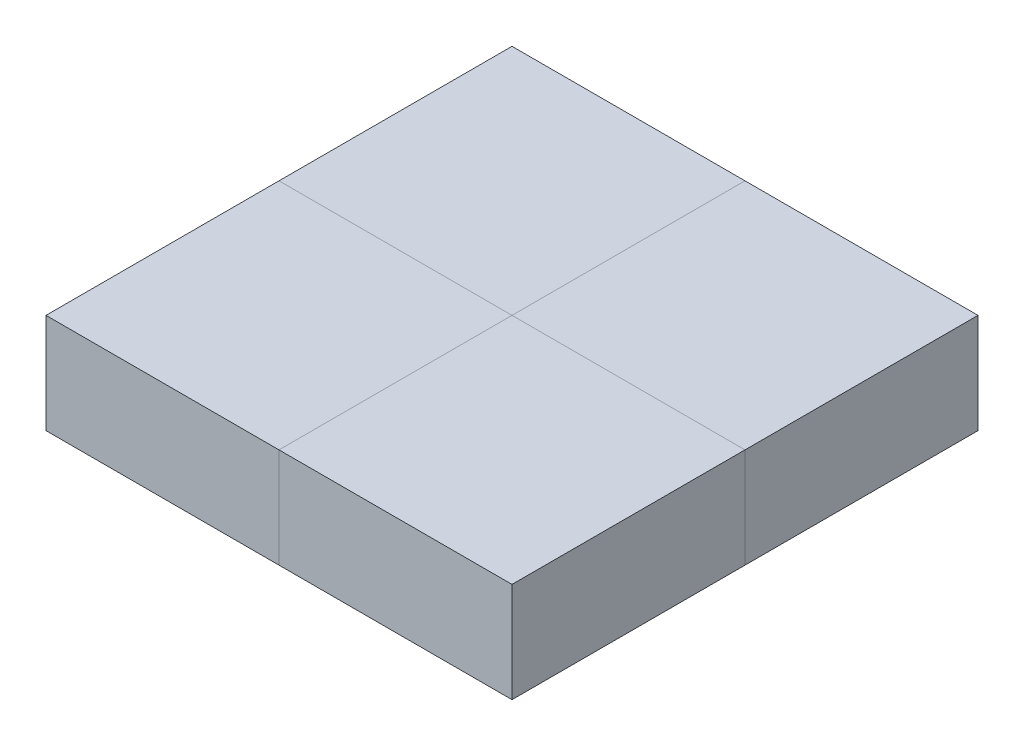
from build123d import *

# Parameters (mm, degrees)
SKETCH1_W           = 44.45
SKETCH1_H           = 44.45
BOSS_EXTRUDE1_DEPTH = 19.05
SKETCH3_W           = 44.45
SKETCH3_H           = 44.45
BOSS_EXTRUDE2_DEPTH = 19.05
SKETCH4_W           = 44.45
SKETCH4_H           = 44.45
BOSS_EXTRUDE3_DEPTH = 19.05
SKETCH5_W           = 44.45
SKETCH5_H           = 44.45
BOSS_EXTRUDE4_DEPTH = 19.05


with BuildPart() as part:
    # Sketch1 → Boss-Extrude1 (new body)
    with BuildSketch(Plane(origin=(0, 0, 0), x_dir=(1, 0, 0), z_dir=(0, 1, 0))):
        Rectangle(SKETCH1_W, SKETCH1_H)
    extrude(amount=BOSS_EXTRUDE1_DEPTH)


with BuildPart() as body_2:
    # Sketch3 → Boss-Extrude2 (new body)
    with BuildSketch(Plane(origin=(0, 0, 0), x_dir=(1, 0, 0), z_dir=(0, 1, 0))):
        with Locations((44.45, 0)):
            Rectangle(SKETCH3_W, SKETCH3_H)
    extrude(amount=BOSS_EXTRUDE2_DEPTH)


with BuildPart() as body_3:
    # Sketch4 → Boss-Extrude3 (new body)
    with BuildSketch(Plane(origin=(0, 0, 0), x_dir=(1, 0, 0), z_dir=(0, 1, 0))):
        with Locations((0, -44.45)):
            Rectangle(SKETCH4_W, SKETCH4_H)
    extrude(amount=BOSS_EXTRUDE3_DEPTH)


with BuildPart() as body_4:
    # Sketch5 → Boss-Extrude4 (new body)
    with BuildSketch(Plane(origin=(0, 0, 0), x_dir=(1, 0, 0), z_dir=(0, 1, 0))):
        with Locations((44.45, -44.45)):
            Rectangle(SKETCH5_W, SKETCH5_H)
    extrude(amount=BOSS_EXTRUDE4_DEPTH)


solid = Compound([part.part, body_2.part, body_3.part, body_4.part])
